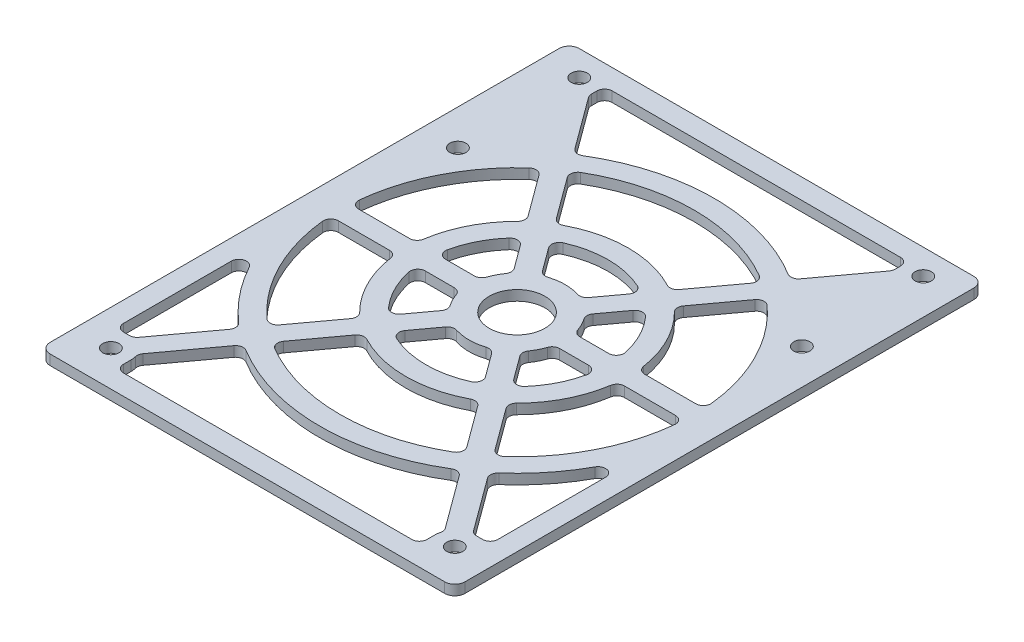
from build123d import *

# Parameters (mm, degrees)
SKETCH_1_W          = 82
SKETCH_1_H          = 104.6
EXTRUDE_1_DEPTH     = 2
SKETCH_2_R          = 1.6
CUT_EXTRUDE_1_DEPTH = 10
CUT_EXTRUDE_2_DEPTH = 10
SKETCH_5_R          = 39
SKETCH_5_R_2        = 35
SKETCH_5_R_3        = 22
SKETCH_5_R_4        = 18
SKETCH_5_R_5        = 9.5
SKETCH_5_R_6        = 5.5
SKETCH_5_W          = 74
SKETCH_5_H          = 4
EXTRUDE_2_DEPTH     = 2
EXTRUDE_2_2_DEPTH   = 2
SKETCH_7_R          = 5.5
SKETCH_7_R_2        = 1.6
CUT_EXTRUDE_3_DEPTH = 2
FILLET_1_R          = 1.5
FILLET_2_R          = 2


with BuildPart() as part:
    # 草图1 → Extrude 1 (new body)
    with BuildSketch(Plane(origin=(0, 0, 0), x_dir=(1, 0, 0), z_dir=(0, 1, 0))):
        Rectangle(SKETCH_1_W, SKETCH_1_H)
    extrude(amount=EXTRUDE_1_DEPTH)

    # 草图2 → 切除-拉伸1 (cut)
    with BuildSketch(Plane(origin=(0, 2, 0), x_dir=(1, 0, 0), z_dir=(0, 1, 0))):
        with Locations(Location((-34, -45.3, 0), (0, 0, 270))):
            Circle(SKETCH_2_R)
        with Locations(Location((-34, 23.3, 0), (0, 0, 270))):
            Circle(SKETCH_2_R)
        with Locations(Location((34, 47.3, 0), (0, 0, 270))):
            Circle(SKETCH_2_R)
        with Locations(Location((34, -45.3, 0), (0, 0, 270))):
            Circle(SKETCH_2_R)
        with Locations(Location((34, 23.3, 0), (0, 0, 270))):
            Circle(SKETCH_2_R)
    extrude(amount=-CUT_EXTRUDE_1_DEPTH, mode=Mode.SUBTRACT)

    # 草图3 → 切除-拉伸2 (cut)
    with BuildSketch(Plane(origin=(0, 2, 0), x_dir=(1, 0, 0), z_dir=(0, 1, 0))):
        with BuildLine():
            Line((30, 48.3), (-30, 48.3))
            Line((-30, 48.3), (-30, 23.3))
            ThreePointArc((-30, 23.3), (-31.171572875, 20.471572875), (-34, 19.3))
            Line((-34, 19.3), (-37, 19.3))
            Line((-37, 19.3), (-37, -41.3))
            Line((-37, -41.3), (-34, -41.3))
            ThreePointArc((-34, -41.3), (-31.171572875, -42.471572875), (-30, -45.3))
            Line((-30, -45.3), (-30, -48.3))
            Line((-30, -48.3), (30, -48.3))
            Line((30, -48.3), (30, -45.3))
            ThreePointArc((30, -45.3), (31.171572875, -42.471572875), (34, -41.3))
            Line((34, -41.3), (37, -41.3))
            Line((37, -41.3), (37, 19.3))
            Line((37, 19.3), (34, 19.3))
            ThreePointArc((34, 19.3), (31.171572875, 20.471572875), (30, 23.3))
            Line((30, 23.3), (30, 48.3))
        make_face()
    extrude(amount=-CUT_EXTRUDE_2_DEPTH, mode=Mode.SUBTRACT)

    # 草图5 → Extrude 2 (add)
    # profile 1 of 6: a face of its own
    with BuildSketch(Plane(origin=(0, 2, 0), x_dir=(1, 0, 0), z_dir=(0, 1, 0))):
        with Locations((0, 1)):
            Circle(SKETCH_5_R)
        with Locations((0, 1)):
            Circle(SKETCH_5_R_2, mode=Mode.SUBTRACT)
    # profile 2 of 6: a face of its own
    with BuildSketch(Plane(origin=(0, 2, 0), x_dir=(1, 0, 0), z_dir=(0, 1, 0))):
        with Locations((0, 1)):
            Circle(SKETCH_5_R_3)
        with Locations((0, 1)):
            Circle(SKETCH_5_R_4, mode=Mode.SUBTRACT)
    # profile 3 of 6: a face of its own
    with BuildSketch(Plane(origin=(0, 2, 0), x_dir=(1, 0, 0), z_dir=(0, 1, 0))):
        with Locations((0, 1)):
            Circle(SKETCH_5_R_5)
        with Locations((0, 1)):
            Circle(SKETCH_5_R_6, mode=Mode.SUBTRACT)
    # profile 4 of 6: a face of its own
    with BuildSketch(Plane(origin=(0, 2, 0), x_dir=(1, 0, 0), z_dir=(0, 1, 0))):
        Polygon((32.387965187, 48.483783664), (-35.612034813, -44.116216336), (-32.387965187, -46.483783664), (35.612034813, 46.116216336), align=None)
    # profile 5 of 6: a face of its own
    with BuildSketch(Plane(origin=(0, 2, 0), x_dir=(1, 0, 0), z_dir=(0, 1, 0))):
        Polygon((35.612034813, -44.116216336), (-32.387965187, 48.483783664), (-35.612034813, 46.116216336), (32.387965187, -46.483783664), align=None)
    # profile 6 of 6: a face of its own
    with BuildSketch(Plane(origin=(0, 2, 0), x_dir=(1, 0, 0), z_dir=(0, 1, 0))):
        with Locations((0, 1)):
            Rectangle(SKETCH_5_W, SKETCH_5_H)
    extrude(amount=-EXTRUDE_2_DEPTH)

    # 草图6 → Extrude 2 2 (add)
    with BuildSketch(Plane(origin=(0, 2, 0), x_dir=(1, 0, 0), z_dir=(0, 1, 0))):
        with BuildLine():
            Line((-37, 19.3), (-37, 13.328828006))
            ThreePointArc((-37, 13.328828006), (-35.844528967, 16.367815172), (-34.439947735, 19.3))
            Line((-34.439947735, 19.3), (-37, 19.3))
        make_face()
        with BuildLine():
            Line((-30, 38.4739454), (-30, 25.919871589))
            ThreePointArc((-30, 25.919871589), (-27.460385865, 28.693450637), (-24.665442846, 31.209533747))
            Line((-24.665442846, 31.209533747), (-30, 38.4739454))
        make_face()
        with BuildLine():
            Line((37, 13.328828006), (37, 19.3))
            Line((37, 19.3), (34.439947735, 19.3))
            ThreePointArc((34.439947735, 19.3), (35.844528967, 16.367815172), (37, 13.328828006))
        make_face()
        with BuildLine():
            Line((30, 38.4739454), (24.665442846, 31.209533747))
            ThreePointArc((24.665442846, 31.209533747), (27.460385865, 28.693450637), (30, 25.919871589))
            Line((30, 25.919871589), (30, 38.4739454))
        make_face()
    extrude(amount=-EXTRUDE_2_2_DEPTH)

    # 草图7 → 切除-拉伸3 (cut)
    with BuildSketch(Plane(origin=(0, 2, 0), x_dir=(1, 0, 0), z_dir=(0, 1, 0))):
        with Locations((0, 1)):
            Circle(SKETCH_7_R)
        with Locations(Location((34, -45.3, 0), (0, 0, 270))):
            Circle(SKETCH_7_R_2)
        with Locations(Location((-34, -45.3, 0), (0, 0, 270))):
            Circle(SKETCH_7_R_2)
        with Locations(Location((34, 47.3, 0), (0, 0, 270))):
            Circle(SKETCH_7_R_2)
        with Locations(Location((-34, 47.3, 0), (0, 0, 270))):
            Circle(SKETCH_7_R_2)
    extrude(amount=-CUT_EXTRUDE_3_DEPTH, mode=Mode.SUBTRACT)

    # 圆角1
    fillet_1_edges = [part.edges().sort_by_distance(p)[0] for p in [
        (-7.10898623, 1, -7.301770766),
        (3.884916604, 1, 7.669338093),
        (-12.200117784, 1, -14.23469403),
        (8.976048159, 1, 14.602261357),
        (-8.976048159, 1, 14.602261357),
        (12.200117784, 1, -14.23469403),
        (-14.57973513, 1, -17.475172944),
        (11.355665504, 1, 17.842740272),
        (-22.294398883, 1, -27.980729761),
        (19.070329257, 1, 28.348297089),
        (-19.070329257, 1, 28.348297089),
        (22.294398883, 1, -27.980729761),
        (-11.355665504, 1, 17.842740272),
        (14.57973513, 1, -17.475172944),
        (-14.57973513, 1, 15.475172944),
        (11.355665504, 1, -19.842740272),
        (-11.355665504, 1, -19.842740272),
        (14.57973513, 1, 15.475172944),
        (-19.070329257, 1, -30.348297089),
        (22.294398883, 1, 25.980729761),
        (-22.294398883, 1, 25.980729761),
        (19.070329257, 1, -30.348297089),
        (-7.10898623, 1, 5.301770766),
        (3.884916604, 1, -9.669338093),
        (-3.884916604, 1, -9.669338093),
        (7.10898623, 1, 5.301770766),
        (-8.976048159, 1, -16.602261357),
        (12.200117784, 1, 12.23469403),
        (-12.200117784, 1, 12.23469403),
        (8.976048159, 1, -16.602261357),
        (-21.9089023, 1, 1),
        (21.9089023, 1, 1),
        (-34.942810419, 1, 1),
        (34.942810419, 1, 1),
        (-9.287087811, 1, 1),
        (9.287087811, 1, 1),
        (-17.88854382, 1, 1),
        (17.88854382, 1, 1),
        (-21.9089023, 1, -3),
        (21.9089023, 1, -3),
        (-34.942810419, 1, -3),
        (34.942810419, 1, -3),
        (-9.287087811, 1, -3),
        (9.287087811, 1, -3),
        (-3.884916604, 1, 7.669338093),
        (7.10898623, 1, -7.301770766),
        (-17.88854382, 1, -3),
        (17.88854382, 1, -3),
        (24.665442846, 1, 29.209533747),
        (-21.441373221, 1, -33.577101074),
        (37, 1, 11.328828006),
        (37, 1, 41.3),
        (33.561661362, 1, 41.324090137),
        (-24.665442846, 1, 29.209533747),
        (21.441373221, 1, -33.577101074),
        (-30, 1, -45.231936953),
        (-30, 1, -48.3),
        (30, 1, -48.3),
        (30, 1, -45.231936953),
        (-33.561661362, 1, 41.324090137),
        (-37, 1, 41.3),
        (-37, 1, 11.328828006),
        (-21.441373221, 1, 31.577101074),
        (21.441373221, 1, 31.577101074),
        (30.337591736, 1, 43.691657465),
        (30, 1, 48.3),
        (-30, 1, 48.3),
        (-30.337591736, 1, 43.691657465),
    ]]
    fillet(fillet_1_edges, radius=FILLET_1_R)

    # 圆角2
    fillet_2_edges = [part.edges().sort_by_distance(p)[0] for p in [
        (41, 1, 52.3),
        (-41, 1, 52.3),
        (-41, 1, -52.3),
        (41, 1, -52.3),
    ]]
    fillet(fillet_2_edges, radius=FILLET_2_R)


solid = part.part
